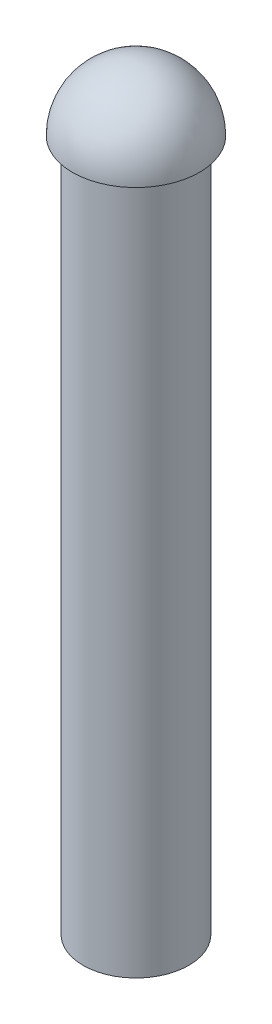
from build123d import *

# Parameters (mm, degrees)
REVOLVE_1_ANGLE = 180
SKETCH_6_W      = 6.5
SKETCH_6_H      = 85


with BuildPart() as part:
    # 草图1 → 旋转1 (revolve)
    with BuildSketch(Plane(origin=(0, 0, 0), x_dir=(1, 0, 0), z_dir=(0, 1, 0))):
        with BuildLine():
            Line((0, 7.8), (0, -7.8))
            ThreePointArc((0, -7.8), (7.8, 0), (0, 7.8))
        make_face()
    revolve(axis=Axis((0, 0, -7.8), (0, 0, 1)), revolution_arc=REVOLVE_1_ANGLE)

    # 草图6 → 旋转2 (revolve)
    with BuildSketch(Plane(origin=(0, 0, 0), x_dir=(0, 0, -1), z_dir=(1, 0, 0)), mode=Mode.PRIVATE) as revolve_2_sk:
        with Locations((3.25, -42.5)):
            Rectangle(SKETCH_6_W, SKETCH_6_H)
    revolve(revolve_2_sk.sketch.rotate(Axis((0, 0, 0), (0, -1, 0)), 180), axis=Axis((0, 0, 0), (0, -1, 0)))


solid = part.part
